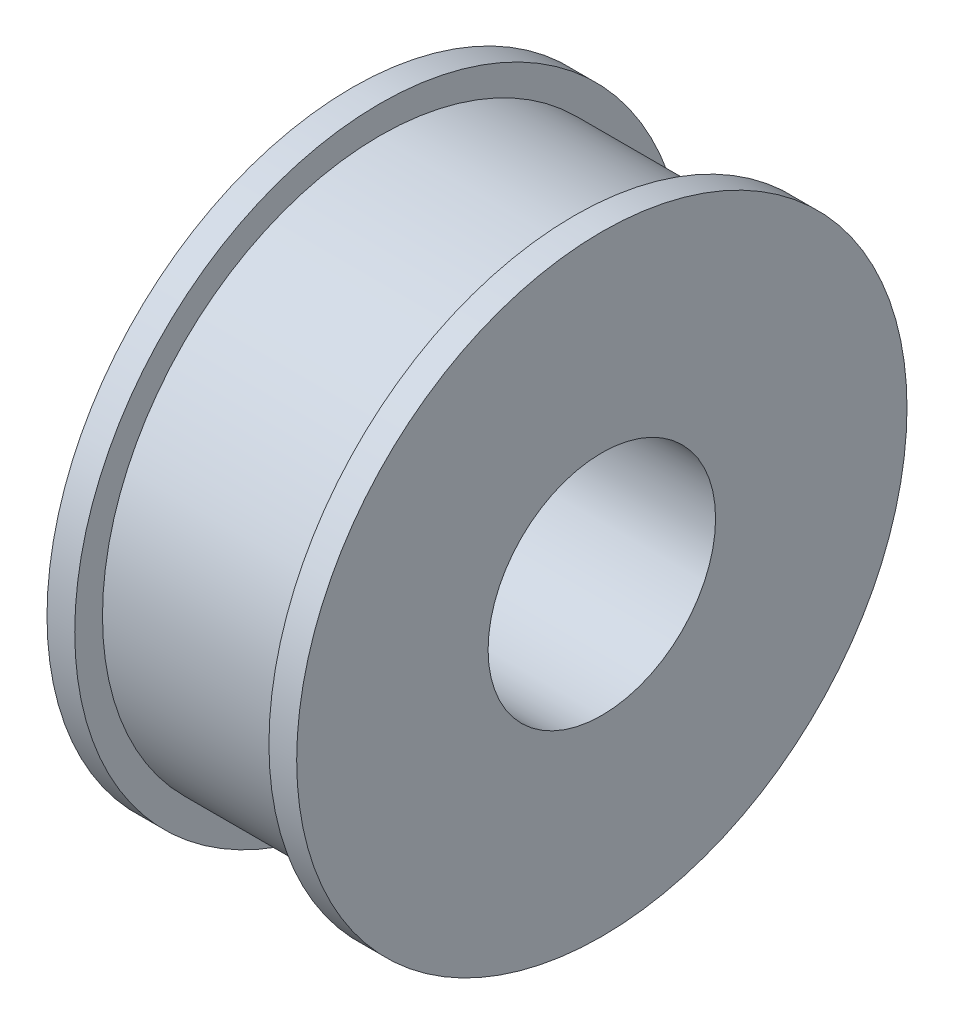
from build123d import *

# Parameters (mm, degrees)
SKETCH1_W = 9
SKETCH1_H = 6.9
SKETCH2_W = 7
SKETCH2_H = 1


with BuildPart() as part:
    # Sketch1 → Revolve1 (revolve)
    with BuildSketch(Plane.XY, mode=Mode.PRIVATE) as revolve1_sk:
        with Locations((-1, 7.55)):
            Rectangle(SKETCH1_W, SKETCH1_H)
    revolve(revolve1_sk.sketch.rotate(Axis((0, 0, 0), (1, 0, 0)), 90), axis=Axis((0, 0, 0), (1, 0, 0)))

    # Sketch2 → Cut-Revolve1 (revolve, cut)
    with BuildSketch(Plane.XY, mode=Mode.PRIVATE) as cut_revolve1_sk:
        with Locations((-1, 10.5)):
            Rectangle(SKETCH2_W, SKETCH2_H)
    revolve(cut_revolve1_sk.sketch.rotate(Axis((0, 0, 0), (1, 0, 0)), 90), axis=Axis((0, 0, 0), (1, 0, 0)), mode=Mode.SUBTRACT)


solid = part.part
